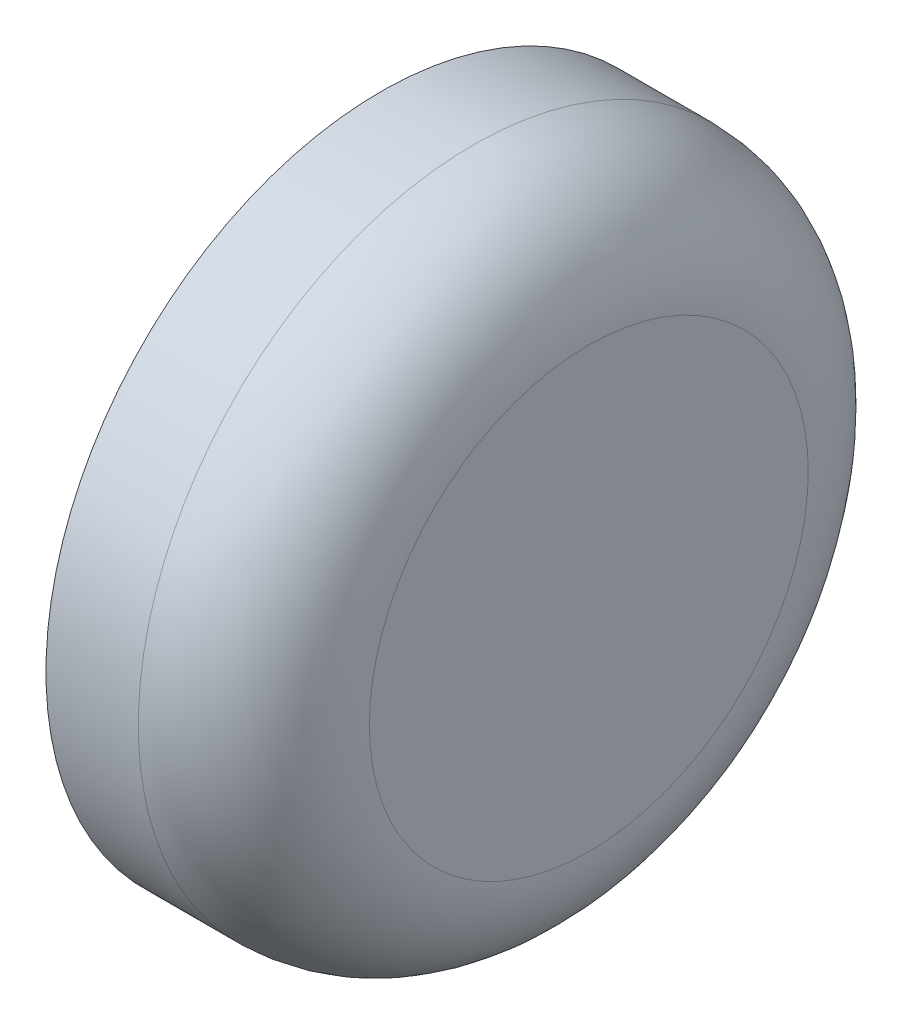
from build123d import *

# Parameters (mm, degrees)
SKETCH2_R           = 7.25
BOSS_EXTRUDE1_DEPTH = 4.5
FILLET1_R           = 2.5
SKETCH3_R           = 3.3
CUT_EXTRUDE1_DEPTH  = 1


with BuildPart() as part:
    # Sketch2 → Boss-Extrude1 (new body)
    with BuildSketch(Plane(origin=(0, 0, 0), x_dir=(0, 0, -1), z_dir=(1, 0, 0))):
        Circle(SKETCH2_R)
    extrude(amount=BOSS_EXTRUDE1_DEPTH)

    # Fillet1
    fillet1_edges = [part.edges().sort_by_distance(p)[0] for p in [
        (4.5, 0, 7.25),
    ]]
    fillet(fillet1_edges, radius=FILLET1_R)

    # Sketch3 → Cut-Extrude1 (cut)
    with BuildSketch(Plane.ZY):
        Circle(SKETCH3_R)
    extrude(amount=-CUT_EXTRUDE1_DEPTH, mode=Mode.SUBTRACT)


solid = part.part
